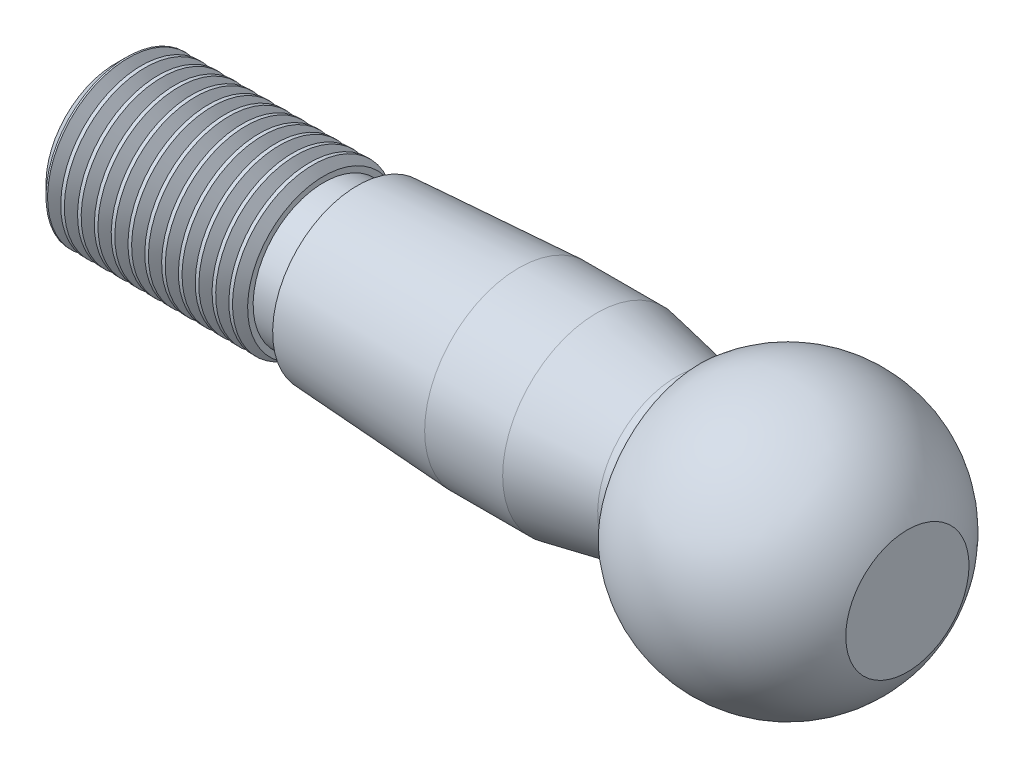
from build123d import *


with BuildPart() as part:
    # Çizim1 → Döndür2 (revolve)
    with BuildSketch(Plane.XY, mode=Mode.PRIVATE) as d_nd_r2_sk:
        with BuildLine():
            Line((58.889857915, -5.151471863), (58.889857915, -0.572124064))
            ThreePointArc((58.889857915, -0.572124064), (51.925602912, 4.66137958), (43.5, 2.447870214))
            Line((43.5, 2.447870214), (43.5, 2.171445263))
            ThreePointArc((43.5, 2.171445263), (42.95411733, 1.014008388), (41.713786507, 0.699004488))
            Line((41.713786507, 0.699004488), (35.8, 1.848528137))
            Line((35.8, 1.848528137), (30, 1.848528137))
            Line((30, 1.848528137), (18, 1.148528137))
            Line((18, 1.148528137), (17.451517244, 0.198528137))
            Line((17.451517244, 0.198528137), (17.278312164, 0.098528137))
            Line((17.278312164, 0.098528137), (15.5, 0.098528137))
            Line((15.5, 0.098528137), (15.5, 0.508911637))
            Line((15.5, 0.508911637), (15.205329949, -0.001471863))
            Line((15.205329949, -0.001471863), (14.71458222, 0.848528137))
            Line((14.71458222, 0.848528137), (14.446077678, 0.848528137))
            Line((14.446077678, 0.848528137), (13.955329949, -0.001471863))
            Line((13.955329949, -0.001471863), (13.46458222, 0.848528137))
            Line((13.46458222, 0.848528137), (13.196077678, 0.848528137))
            Line((13.196077678, 0.848528137), (12.705329949, -0.001471863))
            Line((12.705329949, -0.001471863), (12.21458222, 0.848528137))
            Line((12.21458222, 0.848528137), (11.946077678, 0.848528137))
            Line((11.946077678, 0.848528137), (11.455329949, -0.001471863))
            Line((11.455329949, -0.001471863), (10.96458222, 0.848528137))
            Line((10.96458222, 0.848528137), (10.696077678, 0.848528137))
            Line((10.696077678, 0.848528137), (10.205329949, -0.001471863))
            Line((10.205329949, -0.001471863), (9.71458222, 0.848528137))
            Line((9.71458222, 0.848528137), (9.446077678, 0.848528137))
            Line((9.446077678, 0.848528137), (8.955329949, -0.001471863))
            Line((8.955329949, -0.001471863), (8.46458222, 0.848528137))
            Line((8.46458222, 0.848528137), (8.196077678, 0.848528137))
            Line((8.196077678, 0.848528137), (7.705329949, -0.001471863))
            Line((7.705329949, -0.001471863), (7.21458222, 0.848528137))
            Line((7.21458222, 0.848528137), (6.946077678, 0.848528137))
            Line((6.946077678, 0.848528137), (6.455329949, -0.001471863))
            Line((6.455329949, -0.001471863), (5.96458222, 0.848528137))
            Line((5.96458222, 0.848528137), (5.696077678, 0.848528137))
            Line((5.696077678, 0.848528137), (5.205329949, -0.001471863))
            Line((5.205329949, -0.001471863), (4.71458222, 0.848528137))
            Line((4.71458222, 0.848528137), (4.446077678, 0.848528137))
            Line((4.446077678, 0.848528137), (3.955329949, -0.001471863))
            Line((3.955329949, -0.001471863), (3.46458222, 0.848528137))
            Line((3.46458222, 0.848528137), (3.196077678, 0.848528137))
            Line((3.196077678, 0.848528137), (2.705329949, -0.001471863))
            Line((2.705329949, -0.001471863), (2.21458222, 0.848528137))
            Line((2.21458222, 0.848528137), (1.946077678, 0.848528137))
            Line((1.946077678, 0.848528137), (1.455329949, -0.001471863))
            Line((1.455329949, -0.001471863), (0.96458222, 0.848528137))
            Line((0.96458222, 0.848528137), (0.848528137, 0.848528137))
            Line((0.848528137, 0.848528137), (0, 0))
            Line((0, 0), (0, -5.151471863))
            Line((0, -5.151471863), (6, -5.151471863))
            Line((6, -5.151471863), (7.6, -5.151471863))
            Line((7.6, -5.151471863), (58.889857915, -5.151471863))
        make_face()
    revolve(d_nd_r2_sk.sketch.rotate(Axis((0, -5.151471863, 0), (1, 0, 0)), 180), axis=Axis((0, -5.151471863, 0), (1, 0, 0)))


solid = part.part
